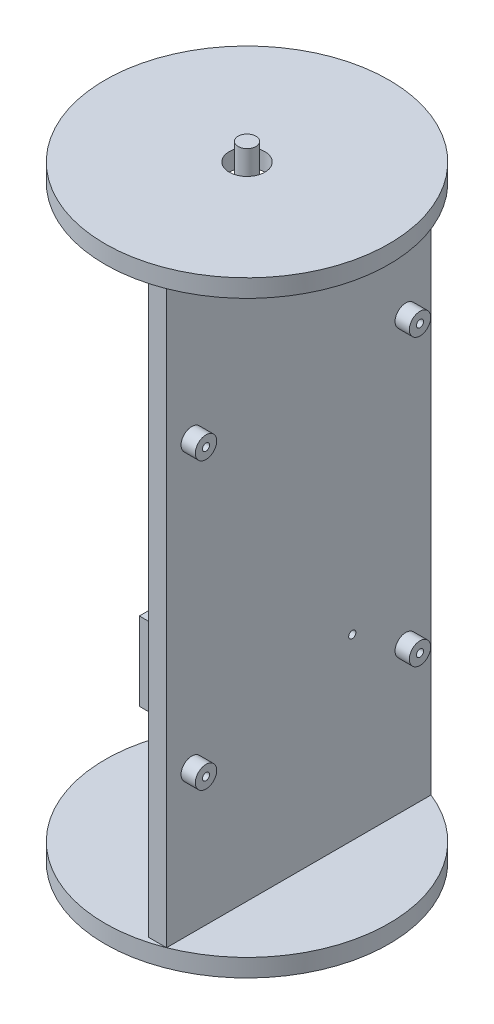
from build123d import *

# Parameters (mm, degrees)
SKETCH1_R           = 50.546
BOSS_EXTRUDE1_DEPTH = 6.35
SKETCH3_W           = 6.35
SKETCH3_H           = 94.144269948
BOSS_EXTRUDE2_DEPTH = 203.2
BOSS_EXTRUDE3_DEPTH = 6.35
CUT_EXTRUDE1_REACH  = 229.426
SKETCH5_R           = 6.35
SKETCH7_R           = 3.175
BOSS_EXTRUDE4_DEPTH = 215.9
SKETCH8_R           = 1.27
CUT_EXTRUDE2_DEPTH  = 237.368563766
SKETCH9_W           = 3.175
SKETCH9_H           = 76.2
BOSS_EXTRUDE5_DEPTH = 19.05
SKETCH10_W          = 19.05
SKETCH10_H          = 2.54
BOSS_EXTRUDE6_DEPTH = 25.4
CUT_EXTRUDE3_REACH  = 203.094
SKETCH11_R          = 1.27
SKETCH12_W          = 17.48
SKETCH12_H          = 27.88
SKETCH12_W_2        = 12.4
SKETCH12_H_2        = 22.8
BOSS_EXTRUDE7_DEPTH = 18.3
SKETCH13_R          = 3.81
SKETCH13_R_2        = 1.27
BOSS_EXTRUDE8_DEPTH = 5.08


with BuildPart() as part:
    # Sketch1 → Boss-Extrude1 (new body)
    with BuildSketch(Plane(origin=(0, 0, 0), x_dir=(1, 0, 0), z_dir=(0, 1, 0))):
        with Locations(Location((0, 0, 0), (0, 0, 270))):
            Circle(SKETCH1_R)
    extrude(amount=BOSS_EXTRUDE1_DEPTH)

    # Sketch3 → Boss-Extrude2 (add)
    with BuildSketch(Plane(origin=(0, 6.35, 0), x_dir=(1, 0, 0), z_dir=(0, 1, 0))):
        with Locations((15.24, 0)):
            Rectangle(SKETCH3_W, SKETCH3_H)
    extrude(amount=BOSS_EXTRUDE2_DEPTH)

    # Sketch4 → Boss-Extrude3 (add)
    with BuildSketch(Plane(origin=(0, 209.55, 0), x_dir=(1, 0, 0), z_dir=(0, 1, 0))):
        with BuildLine():
            ThreePointArc((18.415, 47.072134974), (-50.546, 0), (18.415, -47.072134974))
            ThreePointArc((18.415, -47.072134974), (50.546, 0), (18.415, 47.072134974))
        make_face()
    extrude(amount=BOSS_EXTRUDE3_DEPTH)

    # Sketch5 → Cut-Extrude1 (cut, up to next)
    with BuildSketch(Plane(origin=(0, 215.9, 0), x_dir=(1, 0, 0), z_dir=(0, 1, 0)), mode=Mode.PRIVATE) as cut_extrude1_sk1:
        with Locations(Location((0, 0, 0), (0, 0, 270))):
            Circle(SKETCH5_R)
    cut_extrude1_tool1 = extrude(cut_extrude1_sk1.sketch, amount=-CUT_EXTRUDE1_REACH, mode=Mode.PRIVATE) & part.part
    add(cut_extrude1_tool1.solids().sort_by_distance((0, 215.9, 0))[0], mode=Mode.SUBTRACT)

    # Sketch7 → Boss-Extrude4 (add)
    with BuildSketch(Plane(origin=(0, 6.35, 0), x_dir=(1, 0, 0), z_dir=(0, 1, 0))):
        with Locations(Location((0, 0, 0), (0, 0, 270))):
            Circle(SKETCH7_R)
    extrude(amount=BOSS_EXTRUDE4_DEPTH)

    # Sketch8 → Cut-Extrude2 (cut, through all)
    with BuildSketch(Plane.ZY.offset(-12.065)):
        with Locations((-19.05, 69.85)):
            Circle(SKETCH8_R)
    extrude(amount=-CUT_EXTRUDE2_DEPTH, mode=Mode.SUBTRACT)

    # Sketch9 → Boss-Extrude5 (add)
    with BuildSketch(Plane.ZY.offset(-12.065)):
        with Locations((-45.484634974, 69.85)):
            Rectangle(SKETCH9_W, SKETCH9_H)
    extrude(amount=BOSS_EXTRUDE5_DEPTH)

    # Sketch10 → Boss-Extrude6 (add)
    with BuildSketch(Plane.XY.offset(-43.897134974)):
        with Locations((2.54, 33.02)):
            Rectangle(SKETCH10_W, SKETCH10_H)
    extrude(amount=BOSS_EXTRUDE6_DEPTH)

    # Sketch11 → Cut-Extrude3 (cut, up to next)
    with BuildSketch(Plane(origin=(0, 34.29, 0), x_dir=(1, 0, 0), z_dir=(0, 1, 0)), mode=Mode.PRIVATE) as cut_extrude3_sk1:
        with Locations(Location((-1.905, 36.312665469, 0), (0, 0, 180))):
            Circle(SKETCH11_R)
    cut_extrude3_tool1 = extrude(cut_extrude3_sk1.sketch, amount=-CUT_EXTRUDE3_REACH, mode=Mode.PRIVATE) & part.part
    add(cut_extrude3_tool1.solids().sort_by_distance((-1.905, 34.29, -36.312665))[0], mode=Mode.SUBTRACT)

    # Sketch12 → Boss-Extrude7 (add)
    with BuildSketch(Plane.ZY.offset(-12.065)):
        with Locations((23.352648963, 74.888693437)):
            Rectangle(SKETCH12_W, SKETCH12_H)
        with Locations((23.352648963, 74.888693437)):
            Rectangle(SKETCH12_W_2, SKETCH12_H_2, mode=Mode.SUBTRACT)
    extrude(amount=BOSS_EXTRUDE7_DEPTH)

    # Sketch13 → Boss-Extrude8 (add)
    # profile 1 of 4: a face of its own
    with BuildSketch(Plane(origin=(18.415, 0, 0), x_dir=(0, 0, -1), z_dir=(1, 0, 0))):
        with Locations(Location((-38.1, 158.75, 0), (0, 0, 180))):
            Circle(SKETCH13_R)
        with Locations((-38.1, 158.75)):
            Circle(SKETCH13_R_2, mode=Mode.SUBTRACT)
    # profile 2 of 4: a face of its own
    with BuildSketch(Plane(origin=(18.415, 0, 0), x_dir=(0, 0, -1), z_dir=(1, 0, 0))):
        with Locations(Location((38.1, 158.75, 0), (0, 0, 180))):
            Circle(SKETCH13_R)
        with Locations((38.1, 158.75)):
            Circle(SKETCH13_R_2, mode=Mode.SUBTRACT)
    # profile 3 of 4: a face of its own
    with BuildSketch(Plane(origin=(18.415, 0, 0), x_dir=(0, 0, -1), z_dir=(1, 0, 0))):
        with Locations(Location((-38.1, 57.15, 0), (0, 0, 180))):
            Circle(SKETCH13_R)
        with Locations((-38.1, 57.15)):
            Circle(SKETCH13_R_2, mode=Mode.SUBTRACT)
    # profile 4 of 4: a face of its own
    with BuildSketch(Plane(origin=(18.415, 0, 0), x_dir=(0, 0, -1), z_dir=(1, 0, 0))):
        with Locations(Location((38.1, 57.15, 0), (0, 0, 180))):
            Circle(SKETCH13_R)
        with Locations((38.1, 57.15)):
            Circle(SKETCH13_R_2, mode=Mode.SUBTRACT)
    extrude(amount=BOSS_EXTRUDE8_DEPTH)


solid = part.part
